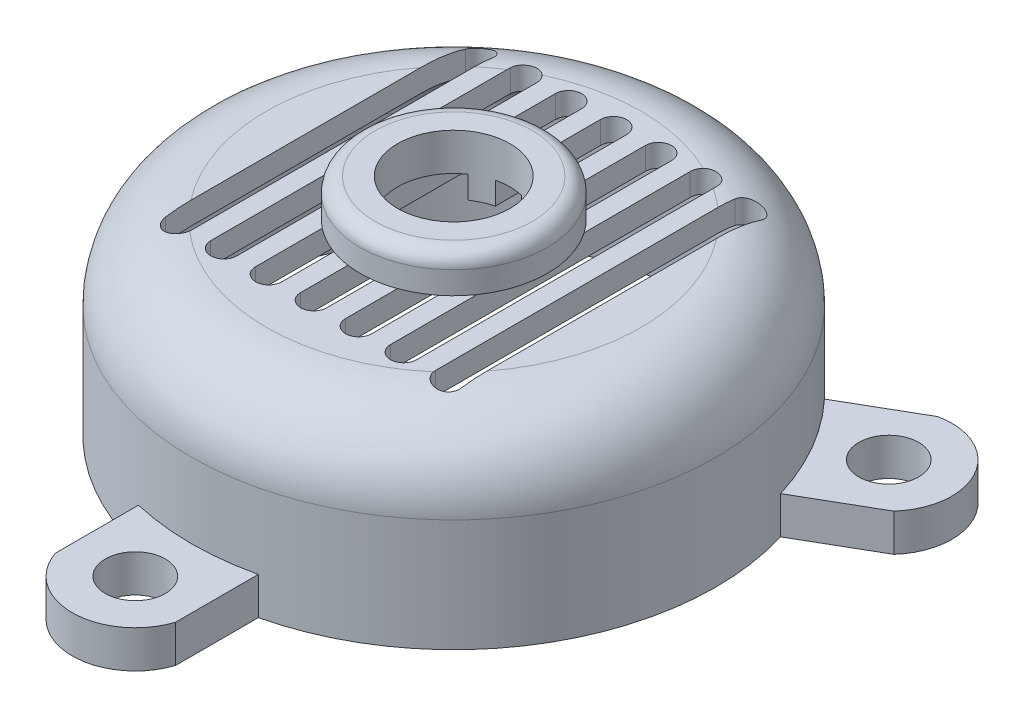
from build123d import *

# Parameters (mm, degrees)
SKETCH1_R           = 35
BOSS_EXTRUDE1_DEPTH = 25
FILLET1_R           = 10
SHELL1_T            = -3
BOSS_EXTRUDE2_DEPTH = 5
SKETCH4_R           = 4
CUT_EXTRUDE1_DEPTH  = 5
CIRPATTERN1_COUNT   = 3
SKETCH5_R           = 7.5
CUT_EXTRUDE2_DEPTH  = 25
SKETCH6_R           = 12.5
BOSS_EXTRUDE3_DEPTH = 5
FILLET2_R           = 2
SKETCH7_R           = 7.5
CUT_EXTRUDE3_DEPTH  = 5
CUT_EXTRUDE4_DEPTH  = 5


with BuildPart() as part:
    # Sketch1 → Boss-Extrude1 (new body)
    with BuildSketch(Plane(origin=(0, 0, 0), x_dir=(1, 0, 0), z_dir=(0, 1, 0))):
        with Locations(Location((0, 0, 0), (0, 0, 270))):
            Circle(SKETCH1_R)
    extrude(amount=BOSS_EXTRUDE1_DEPTH)

    # Fillet1
    fillet1_edges = [part.edges().sort_by_distance(p)[0] for p in [
        (0, 25, -35),
    ]]
    fillet(fillet1_edges, radius=FILLET1_R)

    # Shell1
    shell1_openings = [part.faces().sort_by_distance(p)[0] for p in [
        (0, 0, 0),
    ]]
    offset(amount=SHELL1_T, openings=shell1_openings, kind=Kind.INTERSECTION)

    # Sketch3 → Boss-Extrude2 (add)
    with BuildSketch(Plane(origin=(0, 0, 0), x_dir=(1, 0, 0), z_dir=(0, 1, 0))):
        with BuildLine():
            Line((-8, -45.147025433), (-8, -34.073450075))
            Line((-8, -34.073450075), (8, -34.073450075))
            Line((8, -34.073450075), (8, -45.147025433))
            ThreePointArc((8, -45.147025433), (0, -50.926549925), (-8, -45.147025433))
        make_face()
    boss_extrude2 = extrude(amount=BOSS_EXTRUDE2_DEPTH)

    # Sketch4 → Cut-Extrude1 (cut)
    with BuildSketch(Plane.XZ):
        with Locations(Location((0, 42.5, 0), (0, 0, 270))):
            Circle(SKETCH4_R)
    cut_extrude1 = extrude(amount=-CUT_EXTRUDE1_DEPTH, mode=Mode.SUBTRACT)

    # CirPattern1: Boss-Extrude2, Cut-Extrude1 ×3 about axis
    cirpattern1_axis = Axis((0, 0, 0), (0, 1, 0))
    add([boss_extrude2.rotate(cirpattern1_axis, i * 360 / CIRPATTERN1_COUNT) for i in range(1, CIRPATTERN1_COUNT)])
    add([cut_extrude1.rotate(cirpattern1_axis, i * 360 / CIRPATTERN1_COUNT) for i in range(1, CIRPATTERN1_COUNT)], mode=Mode.SUBTRACT)

    # Sketch5 → Cut-Extrude2 (cut, symmetric)
    with BuildSketch(Plane(origin=(0, 25, 0), x_dir=(1, 0, 0), z_dir=(0, 1, 0))):
        with Locations(Location((0, 0, 0), (0, 0, 270))):
            Circle(SKETCH5_R)
    extrude(amount=CUT_EXTRUDE2_DEPTH, both=True, mode=Mode.SUBTRACT)

    # Sketch6 → Boss-Extrude3 (add)
    with BuildSketch(Plane(origin=(0, 25, 0), x_dir=(1, 0, 0), z_dir=(0, 1, 0))):
        with Locations(Location((0, 0, 0), (0, 0, 270))):
            Circle(SKETCH6_R)
    extrude(amount=BOSS_EXTRUDE3_DEPTH)

    # Fillet2
    fillet2_edges = [part.edges().sort_by_distance(p)[0] for p in [
        (0, 30, -12.5),
    ]]
    fillet(fillet2_edges, radius=FILLET2_R)

    # Sketch7 → Cut-Extrude3 (cut)
    with BuildSketch(Plane(origin=(0, 30, 0), x_dir=(1, 0, 0), z_dir=(0, 1, 0))):
        with Locations(Location((0, 0, 0), (0, 0, 270))):
            Circle(SKETCH7_R)
    extrude(amount=-CUT_EXTRUDE3_DEPTH, mode=Mode.SUBTRACT)

    # Sketch8 → Cut-Extrude4 (cut)
    with BuildSketch(Plane(origin=(0, 25, 0), x_dir=(1, 0, 0), z_dir=(0, 1, 0))):
        with BuildLine():
            Line((-1.75, -18.687717601), (-1.75, 21.312282399))
            ThreePointArc((-1.75, 21.312282399), (0, 23.062282399), (1.75, 21.312282399))
            Line((1.75, 21.312282399), (1.75, -18.687717601))
            ThreePointArc((1.75, -18.687717601), (0, -20.437717601), (-1.75, -18.687717601))
        make_face()
        with BuildLine():
            Line((7.75, -18.687717601), (7.75, 21.312282399))
            ThreePointArc((7.75, 21.312282399), (6, 23.062282399), (4.25, 21.312282399))
            Line((4.25, 21.312282399), (4.25, -18.687717601))
            ThreePointArc((4.25, -18.687717601), (6, -20.437717601), (7.75, -18.687717601))
        make_face()
        with BuildLine():
            Line((13.75, -18.687717601), (13.75, 21.312282399))
            ThreePointArc((13.75, 21.312282399), (12, 23.062282399), (10.25, 21.312282399))
            Line((10.25, 21.312282399), (10.25, -18.687717601))
            ThreePointArc((10.25, -18.687717601), (12, -20.437717601), (13.75, -18.687717601))
        make_face()
        with BuildLine():
            Line((19.75, -18.687717601), (19.75, 21.312282399))
            ThreePointArc((19.75, 21.312282399), (18, 23.062282399), (16.25, 21.312282399))
            Line((16.25, 21.312282399), (16.25, -18.687717601))
            ThreePointArc((16.25, -18.687717601), (18, -20.437717601), (19.75, -18.687717601))
        make_face()
        with BuildLine():
            Line((-7.75, -18.687717601), (-7.75, 21.312282399))
            ThreePointArc((-7.75, 21.312282399), (-6, 23.062282399), (-4.25, 21.312282399))
            Line((-4.25, 21.312282399), (-4.25, -18.687717601))
            ThreePointArc((-4.25, -18.687717601), (-6, -20.437717601), (-7.75, -18.687717601))
        make_face()
        with BuildLine():
            Line((-13.75, -18.687717601), (-13.75, 21.312282399))
            ThreePointArc((-13.75, 21.312282399), (-12, 23.062282399), (-10.25, 21.312282399))
            Line((-10.25, 21.312282399), (-10.25, -18.687717601))
            ThreePointArc((-10.25, -18.687717601), (-12, -20.437717601), (-13.75, -18.687717601))
        make_face()
        with BuildLine():
            Line((-19.75, -18.687717601), (-19.75, 21.312282399))
            ThreePointArc((-19.75, 21.312282399), (-18, 23.062282399), (-16.25, 21.312282399))
            Line((-16.25, 21.312282399), (-16.25, -18.687717601))
            ThreePointArc((-16.25, -18.687717601), (-18, -20.437717601), (-19.75, -18.687717601))
        make_face()
    extrude(amount=-CUT_EXTRUDE4_DEPTH, mode=Mode.SUBTRACT)


solid = part.part
